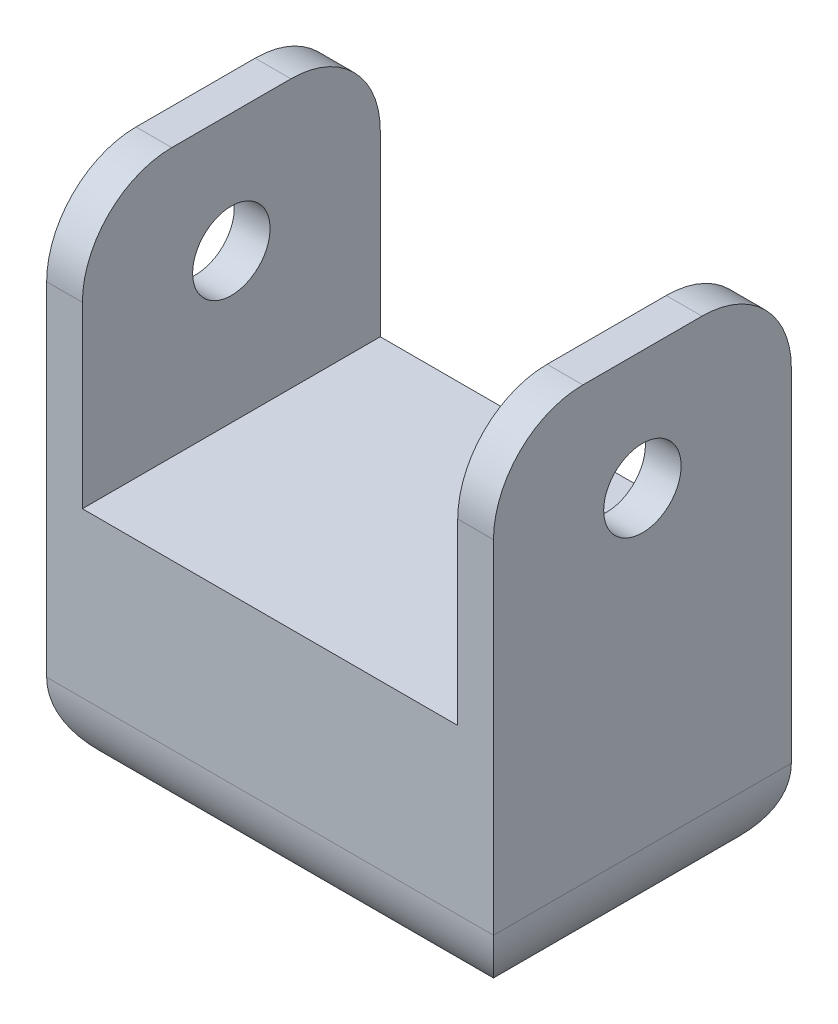
from build123d import *

# Parameters (mm, degrees)
SKETCH1_W           = 38.1
SKETCH1_H           = 25.4
BOSS_EXTRUDE1_DEPTH = 25.4
SKETCH2_W           = 32.004
SKETCH2_H           = 25.4
CUT_EXTRUDE1_DEPTH  = 22.86
SKETCH3_R           = 3.302
CUT_EXTRUDE2_DEPTH  = 48.519048812
FILLET1_R           = 7.62
SKETCH4_W           = 38.1
SKETCH4_H           = 25.4
BOSS_EXTRUDE2_DEPTH = 19.05
FILLET2_R           = 7.62


with BuildPart() as part:
    # Sketch1 → Boss-Extrude1 (new body)
    with BuildSketch(Plane(origin=(0, 0, 0), x_dir=(1, 0, 0), z_dir=(0, 1, 0))):
        Rectangle(SKETCH1_W, SKETCH1_H)
    extrude(amount=BOSS_EXTRUDE1_DEPTH)

    # Sketch2 → Cut-Extrude1 (cut)
    with BuildSketch(Plane(origin=(0, 25.4, 0), x_dir=(1, 0, 0), z_dir=(0, 1, 0))):
        Rectangle(SKETCH2_W, SKETCH2_H)
    extrude(amount=-CUT_EXTRUDE1_DEPTH, mode=Mode.SUBTRACT)

    # Sketch3 → Cut-Extrude2 (cut, through all)
    with BuildSketch(Plane.ZY.offset(19.05)):
        with Locations((0, 15.24)):
            Circle(SKETCH3_R)
    extrude(amount=-CUT_EXTRUDE2_DEPTH, mode=Mode.SUBTRACT)

    # Fillet1
    fillet1_edges = [part.edges().sort_by_distance(p)[0] for p in [
        (-17.526, 25.4, -12.7),
        (17.526, 25.4, 12.7),
        (-17.526, 25.4, 12.7),
        (17.526, 25.4, -12.7),
    ]]
    fillet(fillet1_edges, radius=FILLET1_R)

    # Sketch4 → Boss-Extrude2 (add)
    with BuildSketch(Plane.XZ):
        Rectangle(SKETCH4_W, SKETCH4_H)
    extrude(amount=BOSS_EXTRUDE2_DEPTH)

    # Fillet2
    fillet2_edges = [part.edges().sort_by_distance(p)[0] for p in [
        (-19.05, -19.05, 0),
        (0, -19.05, -12.7),
        (19.05, -19.05, 0),
        (0, -19.05, 12.7),
    ]]
    fillet(fillet2_edges, radius=FILLET2_R)


solid = part.part
